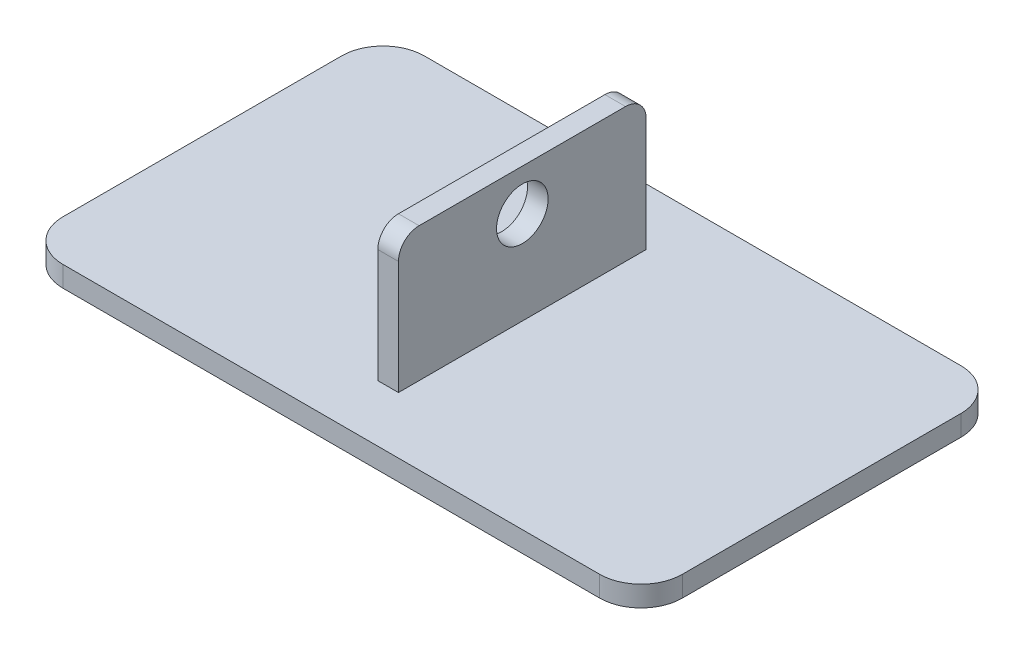
from build123d import *

# Parameters (mm, degrees)
SKETCH1_W           = 300
SKETCH1_H           = 175
BOSS_EXTRUDE1_DEPTH = 10
SKETCH2_W           = 10
SKETCH2_H           = 120
BOSS_EXTRUDE2_DEPTH = 65
CUT_EXTRUDE1_DEPTH  = 10
FILLET1_R           = 10
FILLET2_R           = 20


with BuildPart() as part:
    # Sketch1 → Boss-Extrude1 (new body)
    with BuildSketch(Plane(origin=(0, 0, 0), x_dir=(1, 0, 0), z_dir=(0, 1, 0))):
        Rectangle(SKETCH1_W, SKETCH1_H)
    extrude(amount=BOSS_EXTRUDE1_DEPTH)

    # Sketch2 → Boss-Extrude2 (add)
    with BuildSketch(Plane(origin=(0, 10, 0), x_dir=(1, 0, 0), z_dir=(0, 1, 0))):
        Rectangle(SKETCH2_W, SKETCH2_H)
    extrude(amount=BOSS_EXTRUDE2_DEPTH)

    # Sketch3 → Cut-Extrude1 (cut)
    with BuildSketch(Plane(origin=(5, 0, 0), x_dir=(0, 0, -1), z_dir=(1, 0, 0))):
        with BuildLine():
            ThreePointArc((-12.5, 55), (-8.838834765, 46.161165235), (0, 42.5))
            Line((0, 42.5), (0, 55))
            Line((0, 55), (-12.5, 55))
        make_face()
        with BuildLine():
            Line((0, 55), (0, 42.5))
            ThreePointArc((0, 42.5), (8.838834765, 46.161165235), (12.5, 55))
            Line((12.5, 55), (0, 55))
        make_face()
        with BuildLine():
            Line((-12.5, 55), (0, 55))
            Line((0, 55), (12.5, 55))
            ThreePointArc((12.5, 55), (0, 67.5), (-12.5, 55))
        make_face()
    extrude(amount=-CUT_EXTRUDE1_DEPTH, mode=Mode.SUBTRACT)

    # Fillet1
    fillet1_edges = [part.edges().sort_by_distance(p)[0] for p in [
        (0, 75, -60),
        (0, 75, 60),
    ]]
    fillet(fillet1_edges, radius=FILLET1_R)

    # Fillet2
    fillet2_edges = [part.edges().sort_by_distance(p)[0] for p in [
        (150, 5, 87.5),
        (-150, 5, 87.5),
        (-150, 5, -87.5),
        (150, 5, -87.5),
    ]]
    fillet(fillet2_edges, radius=FILLET2_R)


solid = part.part
